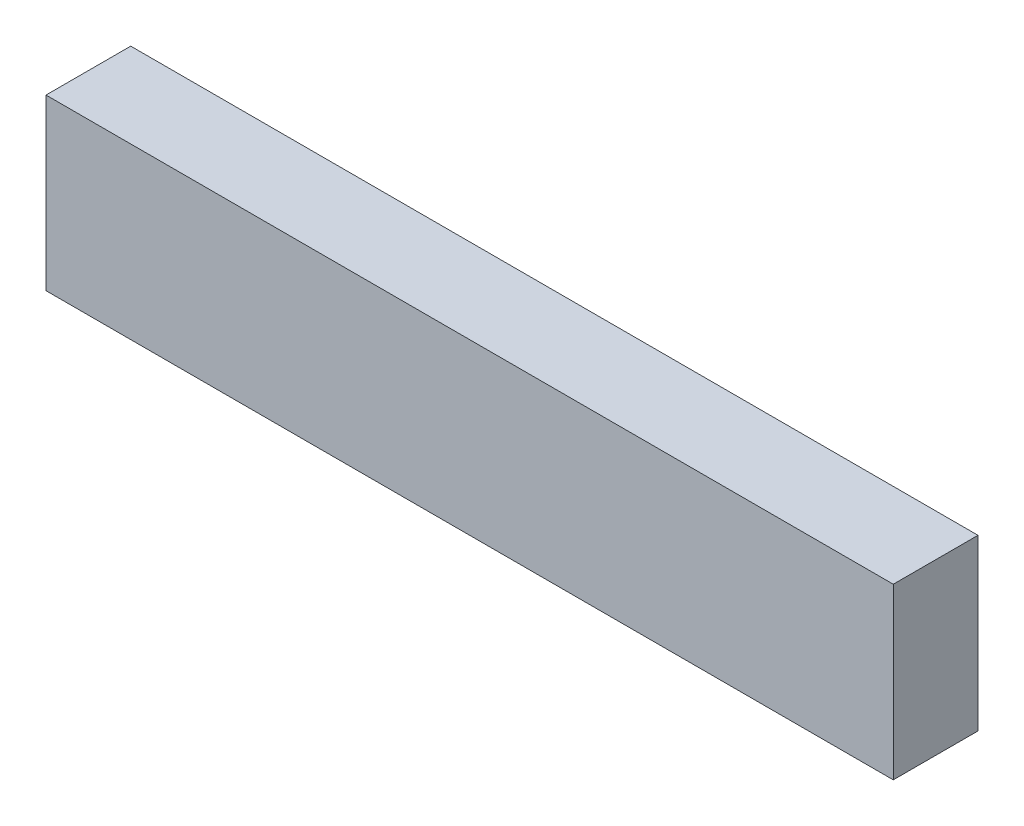
from build123d import *

# Parameters (mm, degrees)
SKETCH1_W      = 254
SKETCH1_H      = 50.8
EXTRUDE1_DEPTH = 25.4


with BuildPart() as part:
    # Sketch1 → Extrude1 (new body)
    with BuildSketch(Plane.XY):
        with Locations((127, 25.4)):
            Rectangle(SKETCH1_W, SKETCH1_H)
    extrude(amount=EXTRUDE1_DEPTH)


solid = part.part
